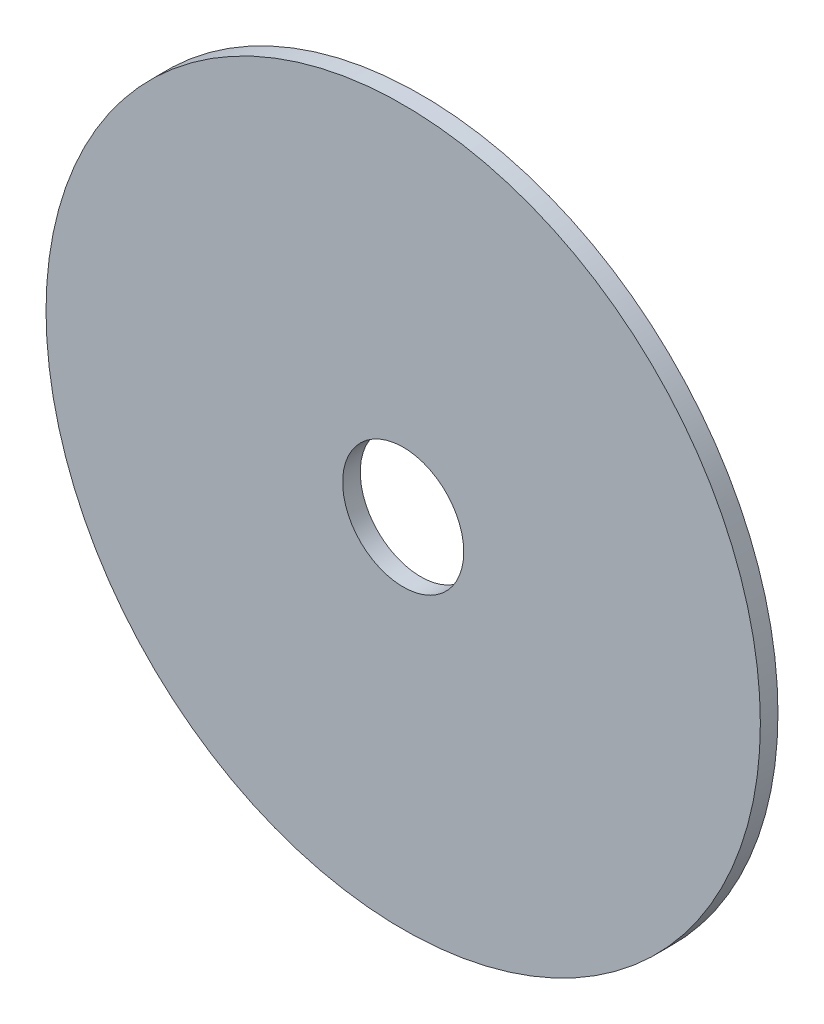
from build123d import *

# Parameters (mm, degrees)
SKETCH1_R           = 64.39
SKETCH1_R_2         = 10.916314701
BOSS_EXTRUDE1_DEPTH = 3.175


with BuildPart() as part:
    # Sketch1 → Boss-Extrude1 (new body)
    with BuildSketch(Plane.XY):
        Circle(SKETCH1_R)
        Circle(SKETCH1_R_2, mode=Mode.SUBTRACT)
    extrude(amount=BOSS_EXTRUDE1_DEPTH)


solid = part.part
